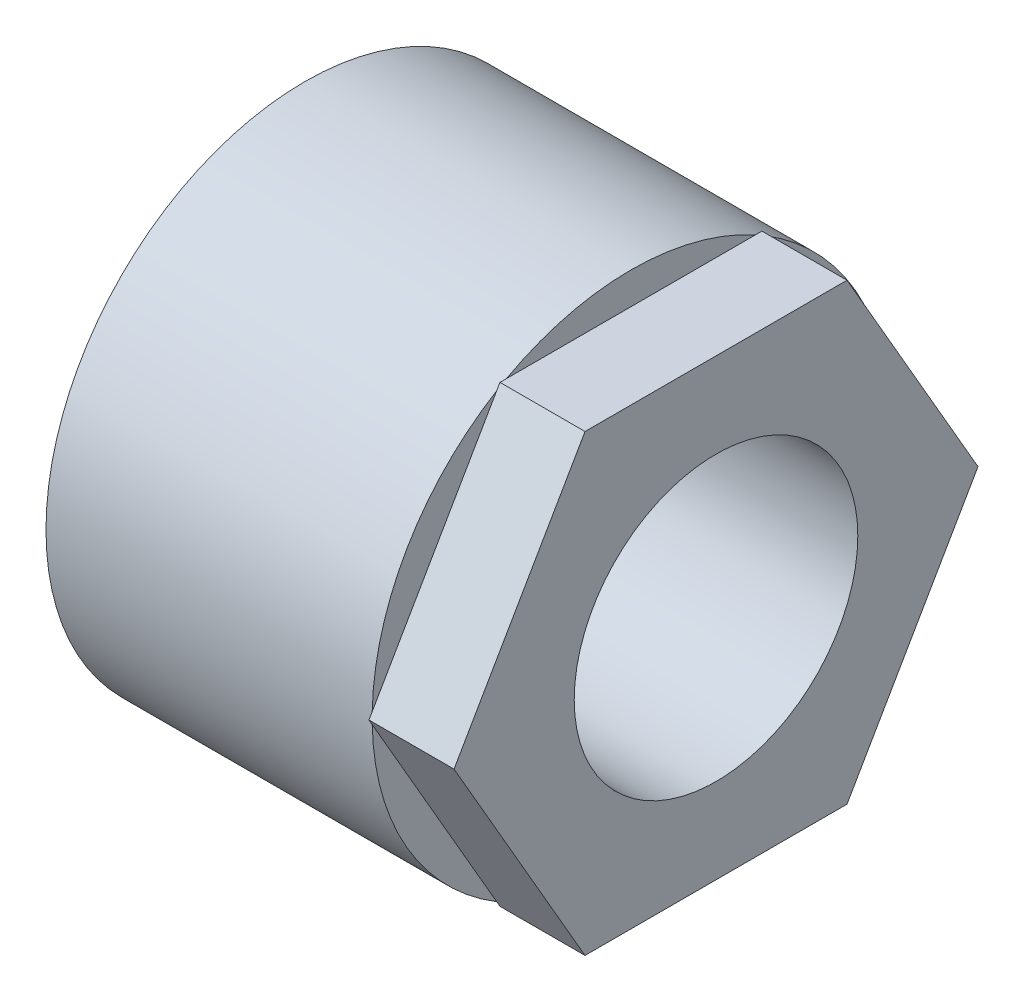
from build123d import *

# Parameters (mm, degrees)
SKETCH_1_W     = 23
SKETCH_1_H     = 8.25
SKETCH_2_R     = 10
F_02_HEX_DEPTH = 6


with BuildPart() as part:
    # 草图1 → 01_SLEEVE (revolve)
    with BuildSketch(Plane.XY, mode=Mode.PRIVATE) as f_01_sleeve_sk:
        with Locations((11.5, 14.125)):
            Rectangle(SKETCH_1_W, SKETCH_1_H)
    revolve(f_01_sleeve_sk.sketch.rotate(Axis((-5, 0, 0), (1, 0, 0)), 90), axis=Axis((-5, 0, 0), (1, 0, 0)))

    # 草图2 → 02_HEX (add)
    with BuildSketch(Plane(origin=(23, 0, 0), x_dir=(0, 0, -1), z_dir=(1, 0, 0))):
        Polygon((18.475208614, 0), (9.237604307, 16), (-9.237604307, 16), (-18.475208614, 0), (-9.237604307, -16), (9.237604307, -16), align=None)
        with Locations(Location((0, 0, 0), (0, 0, 180))):
            Circle(SKETCH_2_R, mode=Mode.SUBTRACT)
    extrude(amount=F_02_HEX_DEPTH)


solid = part.part
